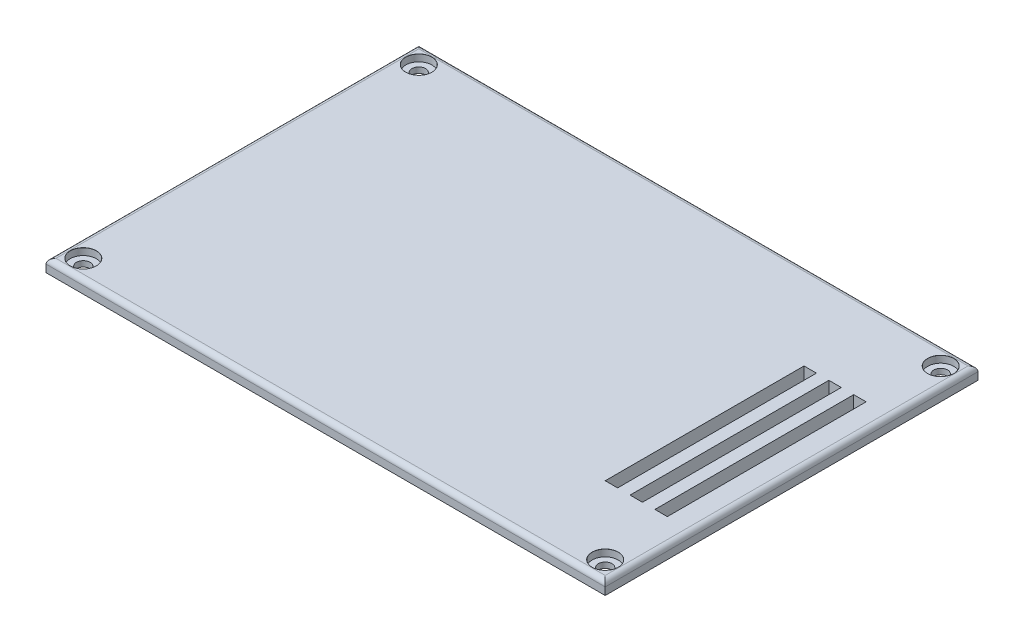
from build123d import *

# Parameters (mm, degrees)
SKETCH1_W                      = 225
SKETCH1_H                      = 150
SKETCH1_W_2                    = 5
SKETCH1_H_2                    = 80
BOSS_EXTRUDE1_DEPTH            = 5
CBORE_FOR_M5_SBHCS1_AT_2_COUNT = 2
CBORE_FOR_M5_SBHCS1_AT_2_PITCH = 210
CBORE_FOR_M5_SBHCS1_AT_3_COUNT = 2
CBORE_FOR_M5_SBHCS1_AT_3_PITCH = 135
CBORE_FOR_M5_SBHCS1_AT_4_COUNT = 2
CBORE_FOR_M5_SBHCS1_AT_4_PITCH = 249.649754656
FILLET1_R                      = 2


with BuildPart() as part:
    # Sketch1 → Boss-Extrude1 (new body)
    with BuildSketch(Plane(origin=(0, 0, 0), x_dir=(1, 0, 0), z_dir=(0, 1, 0))):
        Rectangle(SKETCH1_W, SKETCH1_H)
        with Locations((100, 0)):
            Rectangle(SKETCH1_W_2, SKETCH1_H_2, mode=Mode.SUBTRACT)
        with Locations((90, 0)):
            Rectangle(SKETCH1_W_2, SKETCH1_H_2, mode=Mode.SUBTRACT)
        with Locations((80, 0)):
            Rectangle(SKETCH1_W_2, SKETCH1_H_2, mode=Mode.SUBTRACT)
    extrude(amount=BOSS_EXTRUDE1_DEPTH)

    # Sketch3 → CBORE for M5 SBHCS1 (revolve, cut)
    with BuildSketch(Plane(origin=(-105, 5, -67.5), x_dir=(0, 0, 1), z_dir=(1, 0, 0))):
        Polygon((0, 0), (0, 5), (2.75, 5), (2.75, 2.75), (5.25, 2.75), (5.25, 0.025), (5.275, 0), align=None)
    cbore_for_m5_sbhcs1 = revolve(axis=Axis((-105, 11.35, -67.5), (0, -1, 0)), mode=Mode.SUBTRACT)

    # CBORE for M5 SBHCS1 at 2: CBORE for M5 SBHCS1 ×2
    with Locations(*[(i * CBORE_FOR_M5_SBHCS1_AT_2_PITCH, 0, 0) for i in range(1, CBORE_FOR_M5_SBHCS1_AT_2_COUNT)]):
        add(cbore_for_m5_sbhcs1, mode=Mode.SUBTRACT)

    # CBORE for M5 SBHCS1 at 3: CBORE for M5 SBHCS1 ×2
    with Locations(*[(0, 0, i * CBORE_FOR_M5_SBHCS1_AT_3_PITCH) for i in range(1, CBORE_FOR_M5_SBHCS1_AT_3_COUNT)]):
        add(cbore_for_m5_sbhcs1, mode=Mode.SUBTRACT)

    # CBORE for M5 SBHCS1 at 4: CBORE for M5 SBHCS1 ×2
    with Locations(*[Vector(0.8411784753765537, 0, 0.5407575913134988) * (i * CBORE_FOR_M5_SBHCS1_AT_4_PITCH) for i in range(1, CBORE_FOR_M5_SBHCS1_AT_4_COUNT)]):
        add(cbore_for_m5_sbhcs1, mode=Mode.SUBTRACT)

    # Fillet1
    fillet1_edges = [part.edges().sort_by_distance(p)[0] for p in [
        (-112.5, 5, 0),
        (0, 5, 75),
        (112.5, 5, 0),
        (0, 5, -75),
    ]]
    fillet(fillet1_edges, radius=FILLET1_R)


solid = part.part
